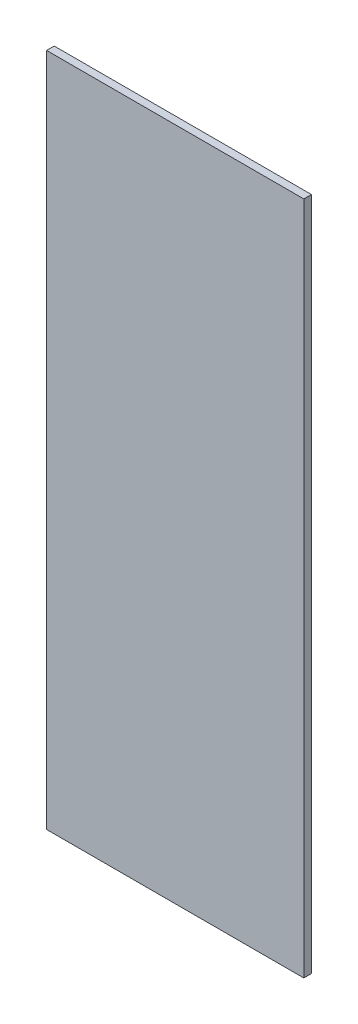
from build123d import *

# Parameters (mm, degrees)
ESBO_O1_W                = 337
ESBO_O1_H                = 884
RESSALTO_EXTRUS_O1_DEPTH = 10


with BuildPart() as part:
    # Esboço1 → Ressalto-extrusão1 (new body)
    with BuildSketch(Plane.XY):
        Rectangle(ESBO_O1_W, ESBO_O1_H)
    extrude(amount=RESSALTO_EXTRUS_O1_DEPTH)


solid = part.part
